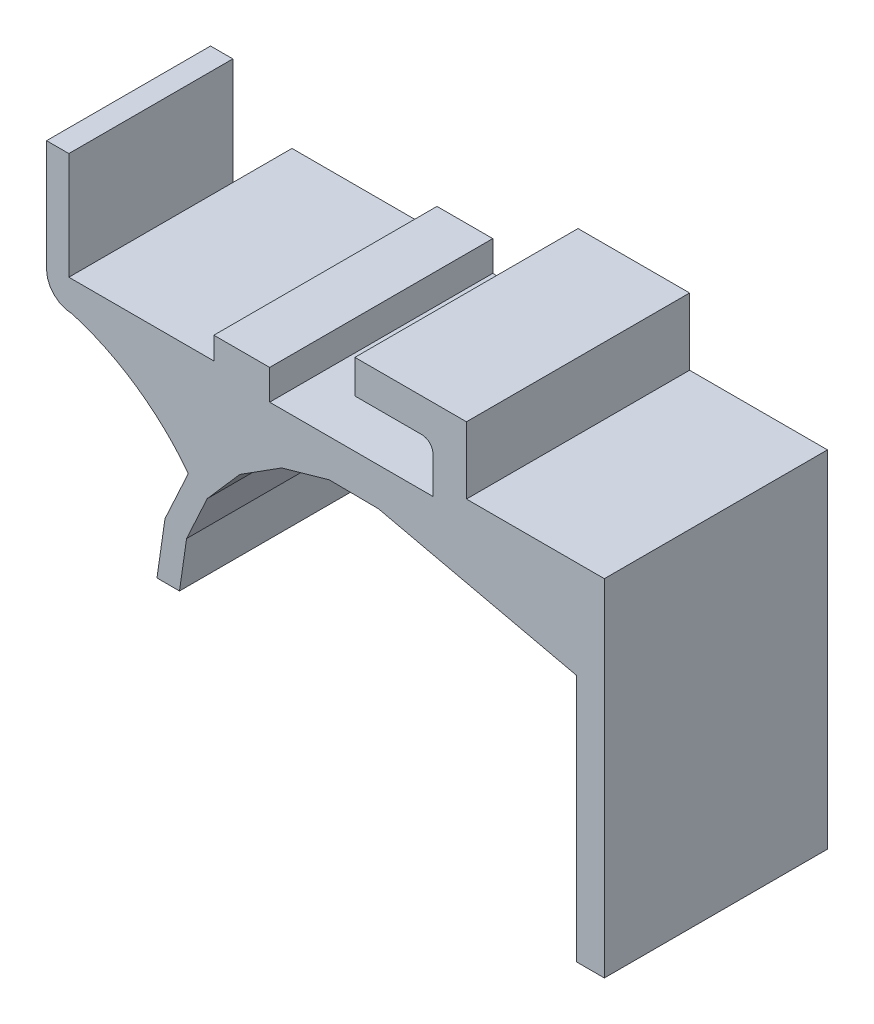
from build123d import *

# Parameters (mm, degrees)
SALIENTE_EXTRUIR1_DEPTH = 20
CORTAR_EXTRUIR1_DEPTH   = 5.3


with BuildPart() as part:
    # Croquis3 → Saliente-Extruir1 (new body)
    with BuildSketch(Plane.XY):
        with BuildLine():
            Line((-51.952746953, -11.691023914), (-51.874375972, -12.286308051))
            Line((-51.874375972, -12.286308051), (-51.644609193, -12.841022845))
            Line((-51.644609193, -12.841022845), (-51.279094792, -13.317369615))
            Line((-51.279094792, -13.317369615), (-50.802748021, -13.68288106))
            Line((-50.802748021, -13.68288106), (-50.24803027, -13.912653752))
            Line((-50.24803027, -13.912653752), (-49.65250662, -13.99148306))
            Line((-49.65250662, -13.99148306), (-48.634298914, -14.325284182))
            Line((-48.634298914, -14.325284182), (-47.63492106, -14.711825449))
            Line((-47.63492106, -14.711825449), (-46.657105279, -15.15005123))
            Line((-46.657105279, -15.15005123), (-45.70351874, -15.638763962))
            Line((-45.70351874, -15.638763962), (-44.776769471, -16.17663006))
            Line((-44.776769471, -16.17663006), (-43.879382708, -16.762176963))
            Line((-43.879382708, -16.762176963), (-43.013812718, -17.393807919))
            Line((-43.013812718, -17.393807919), (-42.182430974, -18.069799027))
            Line((-42.182430974, -18.069799027), (-41.387496586, -18.788302193))
            Line((-41.387496586, -18.788302193), (-40.631179954, -19.547354003))
            Line((-40.631179954, -19.547354003), (-39.91556277, -20.344881636))
            Line((-39.91556277, -20.344881636), (-39.24257888, -21.178708777))
            Line((-39.24257888, -21.178708777), (-41.33719888, -25.732864397))
            Line((-41.33719888, -25.732864397), (-42.055027862, -30.693958319))
            Line((-42.055027862, -30.693958319), (-40.034201485, -30.693958319))
            Line((-40.034201485, -30.693958319), (-39.399249875, -26.305668328))
            Line((-39.399249875, -26.305668328), (-37.546478747, -22.277332194))
            Line((-37.546478747, -22.277332194), (-34.627863462, -18.93937864))
            Line((-34.627863462, -18.93937864), (-30.882804538, -16.565607853))
            Line((-30.882804538, -16.565607853), (-26.81051779, -15.405439974))
            Line((-26.81051779, -15.405439974), (-26.618493511, -15.3507305))
            Line((-26.618493511, -15.3507305), (-22.195772803, -15.394292275))
            Line((-22.195772803, -15.394292275), (-4.431072692, -19.454792623))
            Line((-4.431072692, -19.454792623), (-4.431072692, -41.693958205))
            Line((-4.431072692, -41.693958205), (-1.951072692, -41.693958205))
            Line((-1.951072692, -41.693958205), (-1.951072692, -10.693958394))
            Line((-1.951072692, -10.693958394), (-14.311475216, -10.693958394))
            Line((-14.311475216, -10.693958394), (-14.311475216, -4.693956642))
            Line((-14.311475216, -4.693956642), (-24.311475179, -4.693956642))
            Line((-24.311475179, -4.693956642), (-24.311475179, -7.693958997))
            Line((-24.311475179, -7.693958997), (-18.31147047, -7.693958997))
            ThreePointArc((-18.31147047, -7.693958997), (-17.604362437, -7.986851509), (-17.311465743, -8.69395781))
            Line((-17.311465743, -8.69395781), (-17.311465743, -11.993957443))
            Line((-17.311465743, -11.993957443), (-31.952510471, -11.993957443))
            Line((-31.952510471, -11.993957443), (-31.952510471, -9.293958281))
            Line((-31.952510471, -9.293958281), (-36.952504539, -9.293958281))
            Line((-36.952504539, -9.293958281), (-36.952504539, -11.293958865))
            Line((-36.952504539, -11.293958865), (-49.952506856, -11.293958865))
            Line((-49.952506856, -11.293958865), (-49.952506856, -1.693957245))
            Line((-49.952506856, -1.693957245), (-51.951481378, -1.69383601))
            Line((-51.951481378, -1.69383601), (-51.952746953, -11.691023914))
        make_face()
    extrude(amount=SALIENTE_EXTRUIR1_DEPTH)

    # Croquis4 → Cortar-Extruir1 (cut)
    with BuildSketch(Plane(origin=(0, 0, 0), x_dir=(-1, 0, 0), z_dir=(0, 0, -1))):
        Polygon((49.952506856, -11.293958865), (49.950268445, -13.952068406), (50.24803027, -13.912653752), (50.802748021, -13.68288106), (51.279094792, -13.317369615), (51.644609193, -12.841022845), (51.874375972, -12.286308051), (51.952746953, -11.691023914), (51.951481378, -1.69383601), (49.952506856, -1.693957245), align=None)
    extrude(amount=-CORTAR_EXTRUIR1_DEPTH, mode=Mode.SUBTRACT)


solid = part.part
